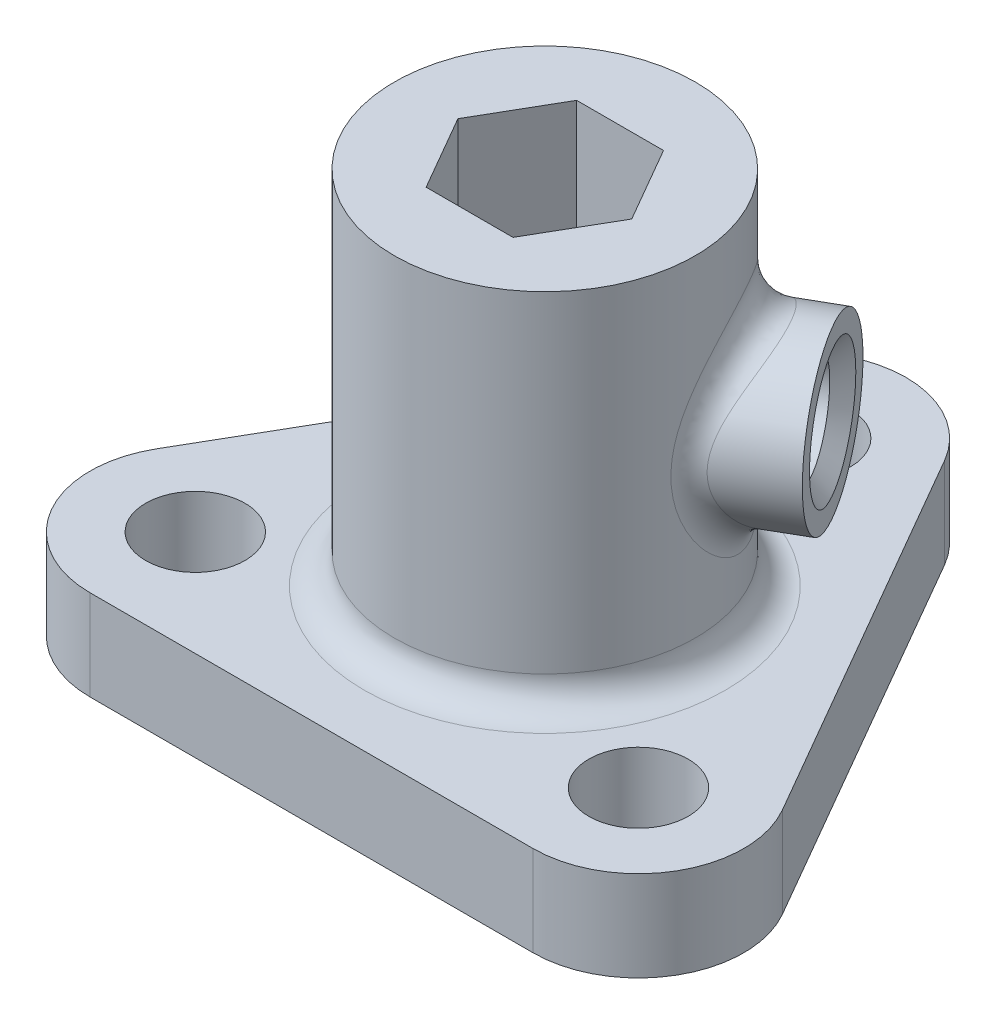
from build123d import *

# Parameters (mm, degrees)
SKETCH4_R                = 1.65
CUT_EXTRUDE4_DEPTH       = 21.784609691
SKETCH5_OUTSIDE_W        = 33.422
SKETCH5_OUTSIDE_H        = 33.422
CUT_EXTRUDE5_DEPTH       = 21.784609691
CUT_EXTRUDE2_DEPTH       = 16
BOSS_EXTRUDE1_REACH      = 27.258
BOSS_EXTRUDE1_END_RADIUS = 5
SKETCH3_R                = 2.75
CUT_EXTRUDE6_REACH       = 27.258
SKETCH6_R                = 1.6
FILLET1_R                = 1
CHAMFER1_SIZE            = 0.5
FILLET2_R                = 1


with BuildPart() as part:
    # Sketch1 → Revolve1 (revolve)
    with BuildSketch(Plane(origin=(0, 0, 0), x_dir=(0, 0, -1), z_dir=(1, 0, 0))):
        Polygon((0, 0), (12, 0), (12, 3), (5, 3), (5, 15), (0, 15), (0, 5.353547723), align=None)
    revolve(axis=Axis((0, 5.353547723, 0), (0, 1, 0)))

    # Sketch4 → Cut-Extrude4 (cut, through all)
    with BuildSketch(Plane(origin=(0, 3, 0), x_dir=(1, 0, 0), z_dir=(0, 1, 0))):
        with Locations(Location((0, 8.5, 0), (0, 0, 270))):
            Circle(SKETCH4_R)
        with Locations(Location((7.361215932, -4.25, 0), (0, 0, 270))):
            Circle(SKETCH4_R)
        with Locations(Location((-7.361215932, -4.25, 0), (0, 0, 270))):
            Circle(SKETCH4_R)
    extrude(amount=-CUT_EXTRUDE4_DEPTH, mode=Mode.SUBTRACT)

    # Sketch5 outside → Cut-Extrude5 (cut, through all)
    with BuildSketch(Plane(origin=(0, 3, 0), x_dir=(1, 0, 0), z_dir=(0, 1, 0))):
        Rectangle(SKETCH5_OUTSIDE_W, SKETCH5_OUTSIDE_H)
        with BuildLine():
            Line((-3.031088913, 10.25), (-10.392304845, -2.5))
            ThreePointArc((-10.392304845, -2.5), (-10.392304845, -6), (-7.361215932, -7.75))
            Line((-7.361215932, -7.75), (7.361215932, -7.75))
            ThreePointArc((7.361215932, -7.75), (10.392304845, -6), (10.392304845, -2.5))
            Line((10.392304845, -2.5), (3.031088913, 10.25))
            ThreePointArc((3.031088913, 10.25), (0, 12), (-3.031088913, 10.25))
        make_face(mode=Mode.SUBTRACT)
    extrude(amount=-CUT_EXTRUDE5_DEPTH, mode=Mode.SUBTRACT)

    # Sketch2 → Cut-Extrude2 (cut)
    with BuildSketch(Plane(origin=(0, 15, 0), x_dir=(1, 0, 0), z_dir=(0, 1, 0))):
        Polygon((2.886751346, 0), (1.443375673, 2.5), (-1.443375673, 2.5), (-2.886751346, 0), (-1.443375673, -2.5), (1.443375673, -2.5), align=None)
    extrude(amount=-CUT_EXTRUDE2_DEPTH, mode=Mode.SUBTRACT)

    # Boss-Extrude1: up to this cylinder (the profile starts outside it)
    boss_extrude1_end = Plane(origin=(0, 9, 0), z_dir=(0, -1, 0)) * Cylinder(BOSS_EXTRUDE1_END_RADIUS, 65.516, mode=Mode.PRIVATE)
    # Sketch3 → Boss-Extrude1 (add, up to the surface)
    with BuildSketch(Plane(origin=(6.062177826, 0, -3.5), x_dir=(-0.5000000000000001, 0, -0.8660254037844386), z_dir=(0.8660254037844386, 0, -0.5000000000000001)), mode=Mode.PRIVATE) as boss_extrude1_sk1:
        with Locations((0, 9)):
            Circle(SKETCH3_R)
    boss_extrude1_tool1 = extrude(boss_extrude1_sk1.sketch, amount=-BOSS_EXTRUDE1_REACH, mode=Mode.PRIVATE) - boss_extrude1_end
    add(boss_extrude1_tool1.solids().sort_by_distance((6.062178, 9, -3.5))[0])

    # Sketch6 → Cut-Extrude6 (cut, up to next)
    with BuildSketch(Plane(origin=(6.062177826, 0, -3.5), x_dir=(-0.5000000000000001, 0, -0.8660254037844386), z_dir=(0.8660254037844386, 0, -0.5000000000000001)), mode=Mode.PRIVATE) as cut_extrude6_sk1:
        with Locations((0, 9)):
            Circle(SKETCH6_R)
    cut_extrude6_tool1 = extrude(cut_extrude6_sk1.sketch, amount=-CUT_EXTRUDE6_REACH, mode=Mode.PRIVATE) & part.part
    add(cut_extrude6_tool1.solids().sort_by_distance((6.062178, 9, -3.5))[0], mode=Mode.SUBTRACT)

    # Fillet1
    fillet1_edges = [part.edges().sort_by_distance(p)[0] for p in [
        (0, 3, 5),
    ]]
    fillet(fillet1_edges, radius=FILLET1_R)

    # Chamfer1
    chamfer1_edges = [part.edges().sort_by_distance(p)[0] for p in [
        (6.862177826, 9, -2.114359354),
    ]]
    chamfer(chamfer1_edges, length=CHAMFER1_SIZE)

    # Fillet2
    fillet2_edges = [part.edges().sort_by_distance(p)[0] for p in [
        (4.991369035, 8.999999998, 0.293658225),
    ]]
    fillet(fillet2_edges, radius=FILLET2_R)


solid = part.part
